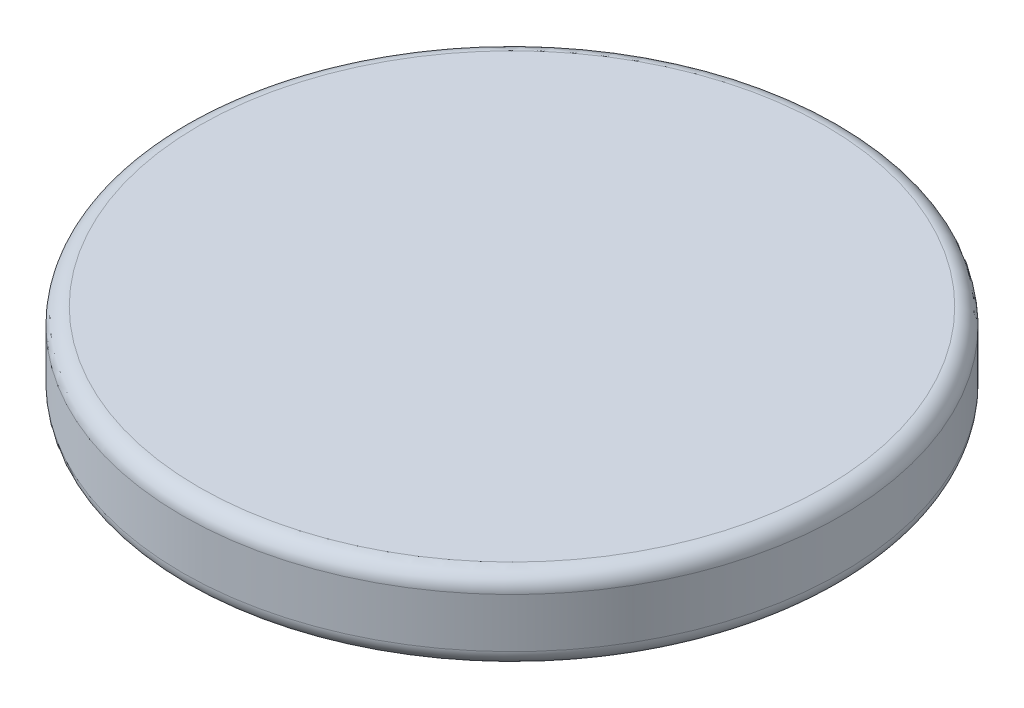
from build123d import *

# Parameters (mm, degrees)
SKETCH_1_R      = 4
EXTRUDE_1_DEPTH = 1
FILLET_1_R      = 0.2


with BuildPart() as part:
    # Эскиз1 → Бобышка-Вытянуть1 (new body)
    with BuildSketch(Plane(origin=(0, 0, 0), x_dir=(1, 0, 0), z_dir=(0, 1, 0))):
        with Locations(Location((0, 0, 0), (0, 0, 270))):
            Circle(SKETCH_1_R)
    extrude(amount=EXTRUDE_1_DEPTH)

    # Скругление1
    fillet_1_edges = [part.edges().sort_by_distance(p)[0] for p in [
        (0, 0, -4),
        (0, 1, -4),
    ]]
    fillet(fillet_1_edges, radius=FILLET_1_R)


solid = part.part
